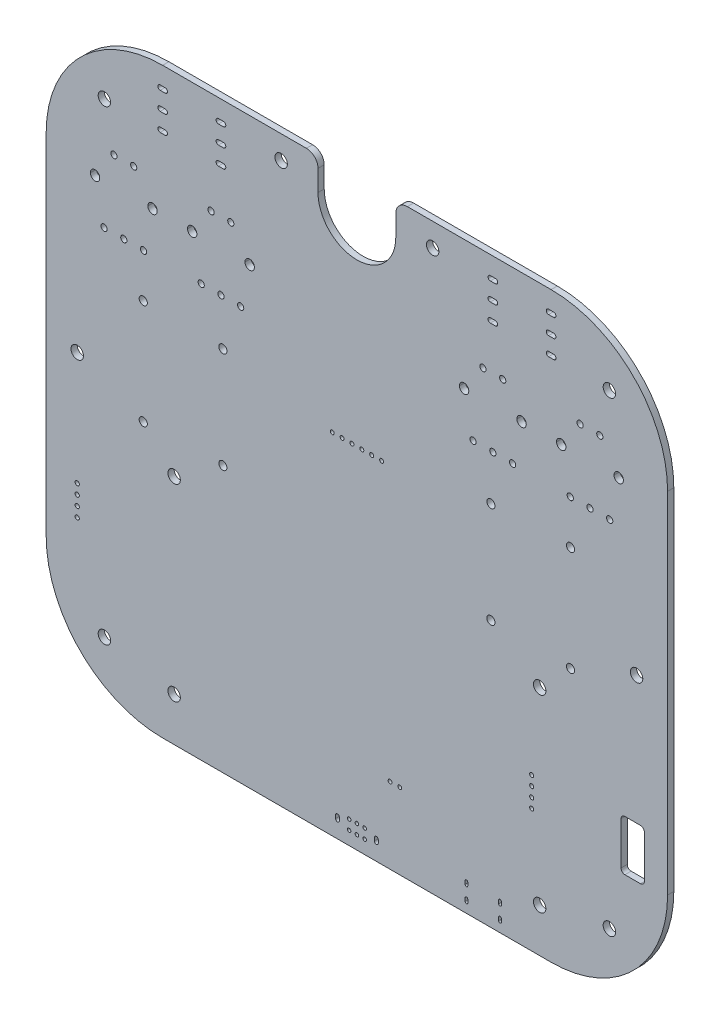
from build123d import *

# Parameters (mm, degrees)
SKETCH_1_R      = 1.6002032
SKETCH_1_R_2    = 0.8
SKETCH_1_R_3    = 1.05000254
SKETCH_1_R_4    = 1.60000254
SKETCH_1_R_5    = 0.52499365
SKETCH_1_R_6    = 0.5
SKETCH_1_R_7    = 0.51000762
SKETCH_1_R_8    = 0.457200914
SKETCH_1_R_9    = 0.5500127
EXTRUDE_1_DEPTH = 1.6000508


with BuildPart() as part:
    # 草图1 → 凸台-拉伸1 (new body)
    with BuildSketch(Plane.XY.offset(1.6000508)):
        with BuildLine():
            Line((0.012700025, 120.00023876), (0.012700025, 30.00006096))
            ThreePointArc((0.012700025, 30.00006096), (8.795794693, 8.795794693), (30.00006096, 0.012700025))
            Line((30.00006096, 0.012700025), (130.000259081, 0.012700025))
            ThreePointArc((130.000259081, 0.012700025), (151.204525347, 8.795794693), (159.987620015, 30.00006096))
            Line((159.987620015, 30.00006096), (159.987620015, 120.00023876))
            ThreePointArc((159.987620015, 120.00023876), (151.204525347, 141.204505027), (130.000259081, 149.987599695))
            Line((130.000259081, 149.987599695), (93.00018542, 149.987599695))
            ThreePointArc((93.00018542, 149.987599695), (90.887841759, 149.112638302), (90.012880366, 147.000294641))
            Line((90.012880366, 147.000294641), (90.012880366, 141.625283211))
            ThreePointArc((90.012880366, 141.625283211), (80.00016002, 131.612562865), (69.987439675, 141.625283211))
            Line((69.987439675, 141.625283211), (69.987439675, 147.000294641))
            ThreePointArc((69.987439675, 147.000294641), (69.112478282, 149.112638302), (67.00013462, 149.987599695))
            Line((67.00013462, 149.987599695), (30.00006096, 149.987599695))
            ThreePointArc((30.00006096, 149.987599695), (8.795794693, 141.204505027), (0.012700025, 120.00023876))
        make_face()
        with Locations(Location((152.000304801, 75.00014986, 0), (0, 0, 180))):
            Circle(SKETCH_1_R, mode=Mode.SUBTRACT)
        with Locations(Location((145.080289561, 106.250419101, 0), (0, 0, 180))):
            Circle(SKETCH_1_R_2, mode=Mode.SUBTRACT)
        with Locations(Location((145.000289561, 15.00003048, 0), (0, 0, 180))):
            Circle(SKETCH_1_R, mode=Mode.SUBTRACT)
        with Locations(Location((145.000289561, 135.000269241, 0), (0, 0, 180))):
            Circle(SKETCH_1_R, mode=Mode.SUBTRACT)
        with Locations(Location((142.540284481, 123.750292101, 0), (0, 0, 180))):
            Circle(SKETCH_1_R_2, mode=Mode.SUBTRACT)
        with Locations(Location((140.000279401, 106.2501651, 0), (0, 0, 180))):
            Circle(SKETCH_1_R_2, mode=Mode.SUBTRACT)
        with Locations(Location((137.460274321, 123.750292101, 0), (0, 0, 180))):
            Circle(SKETCH_1_R_2, mode=Mode.SUBTRACT)
        with Locations(Location((134.920269241, 106.250419101, 0), (0, 0, 180))):
            Circle(SKETCH_1_R_2, mode=Mode.SUBTRACT)
        with Locations(Location((135.000264161, 95.0001905, 0), (0, 0, 180))):
            Circle(SKETCH_1_R_3, mode=Mode.SUBTRACT)
        with Locations(Location((135.000264161, 68.014135128, 0), (0, 0, 180))):
            Circle(SKETCH_1_R_3, mode=Mode.SUBTRACT)
        with Locations(Location((127.050254001, 11.26002286, 0), (0, 0, 180))):
            Circle(SKETCH_1_R_4, mode=Mode.SUBTRACT)
        with Locations(Location((127.050254001, 59.80011938, 0), (0, 0, 180))):
            Circle(SKETCH_1_R_4, mode=Mode.SUBTRACT)
        with Locations(Location((125.00004572, 36.78008382, 0), (0, 0, 180))):
            Circle(SKETCH_1_R_5, mode=Mode.SUBTRACT)
        with Locations(Location((125.00004572, 34.28008382, 0), (0, 0, 180))):
            Circle(SKETCH_1_R_5, mode=Mode.SUBTRACT)
        with Locations(Location((125.00004572, 31.78005842, 0), (0, 0, 180))):
            Circle(SKETCH_1_R_5, mode=Mode.SUBTRACT)
        with Locations(Location((125.00004572, 39.28008382, 0), (0, 0, 180))):
            Circle(SKETCH_1_R_5, mode=Mode.SUBTRACT)
        with Locations(Location((120.0802413, 106.250419101, 0), (0, 0, 180))):
            Circle(SKETCH_1_R_2, mode=Mode.SUBTRACT)
        with Locations(Location((117.54023622, 123.750292101, 0), (0, 0, 180))):
            Circle(SKETCH_1_R_2, mode=Mode.SUBTRACT)
        with Locations(Location((115.00023114, 106.2501651, 0), (0, 0, 180))):
            Circle(SKETCH_1_R_2, mode=Mode.SUBTRACT)
        with Locations(Location((114.50022352, 94.50018796, 0), (0, 0, 180))):
            Circle(SKETCH_1_R_3, mode=Mode.SUBTRACT)
        with Locations(Location((114.50022352, 68.50013716, 0), (0, 0, 180))):
            Circle(SKETCH_1_R_3, mode=Mode.SUBTRACT)
        with Locations(Location((112.46022606, 123.750292101, 0), (0, 0, 180))):
            Circle(SKETCH_1_R_2, mode=Mode.SUBTRACT)
        with Locations(Location((109.92022098, 106.250419101, 0), (0, 0, 180))):
            Circle(SKETCH_1_R_2, mode=Mode.SUBTRACT)
        with Locations(Location((99.50019812, 144.000289561, 0), (0, 0, 180))):
            Circle(SKETCH_1_R_4, mode=Mode.SUBTRACT)
        with Locations(Location((91.039243078, 19.558039116, 0), (0, 0, 180))):
            Circle(SKETCH_1_R_6, mode=Mode.SUBTRACT)
        with Locations(Location((88.539243078, 19.558039116, 0), (0, 0, 180))):
            Circle(SKETCH_1_R_6, mode=Mode.SUBTRACT)
        with Locations(Location((86.35017272, 90.00018034, 0), (0, 0, 180))):
            Circle(SKETCH_1_R_7, mode=Mode.SUBTRACT)
        with Locations(Location((83.81016764, 90.00018034, 0), (0, 0, 180))):
            Circle(SKETCH_1_R_7, mode=Mode.SUBTRACT)
        with Locations(Location((82.00016002, 3.448996698, 0), (0, 0, 180))):
            Circle(SKETCH_1_R_8, mode=Mode.SUBTRACT)
        with Locations(Location((82.00016002, 5.949022098, 0), (0, 0, 180))):
            Circle(SKETCH_1_R_8, mode=Mode.SUBTRACT)
        with Locations(Location((81.27016256, 90.00018034, 0), (0, 0, 180))):
            Circle(SKETCH_1_R_7, mode=Mode.SUBTRACT)
        with Locations(Location((80.00016002, 3.448996698, 0), (0, 0, 180))):
            Circle(SKETCH_1_R_8, mode=Mode.SUBTRACT)
        with Locations(Location((80.00016002, 5.949022098, 0), (0, 0, 180))):
            Circle(SKETCH_1_R_8, mode=Mode.SUBTRACT)
        with Locations(Location((78.73015748, 90.00018034, 0), (0, 0, 180))):
            Circle(SKETCH_1_R_7, mode=Mode.SUBTRACT)
        with Locations(Location((78.00016002, 5.949022098, 0), (0, 0, 180))):
            Circle(SKETCH_1_R_8, mode=Mode.SUBTRACT)
        with Locations(Location((78.00016002, 3.448996698, 0), (0, 0, 180))):
            Circle(SKETCH_1_R_8, mode=Mode.SUBTRACT)
        with Locations(Location((76.1901524, 90.00018034, 0), (0, 0, 180))):
            Circle(SKETCH_1_R_7, mode=Mode.SUBTRACT)
        with Locations(Location((73.65014732, 90.00018034, 0), (0, 0, 180))):
            Circle(SKETCH_1_R_7, mode=Mode.SUBTRACT)
        with Locations(Location((60.50012192, 144.000289561, 0), (0, 0, 180))):
            Circle(SKETCH_1_R_4, mode=Mode.SUBTRACT)
        with Locations(Location((50.08009906, 106.250419101, 0), (0, 0, 180))):
            Circle(SKETCH_1_R_2, mode=Mode.SUBTRACT)
        with Locations(Location((47.54009398, 123.750292101, 0), (0, 0, 180))):
            Circle(SKETCH_1_R_2, mode=Mode.SUBTRACT)
        with Locations(Location((45.50009144, 94.514196088, 0), (0, 0, 180))):
            Circle(SKETCH_1_R_3, mode=Mode.SUBTRACT)
        with Locations(Location((45.50009144, 68.514145288, 0), (0, 0, 180))):
            Circle(SKETCH_1_R_3, mode=Mode.SUBTRACT)
        with Locations(Location((45.0000889, 106.2501651, 0), (0, 0, 180))):
            Circle(SKETCH_1_R_2, mode=Mode.SUBTRACT)
        with Locations(Location((42.46008382, 123.750292101, 0), (0, 0, 180))):
            Circle(SKETCH_1_R_2, mode=Mode.SUBTRACT)
        with Locations(Location((39.92007874, 106.250419101, 0), (0, 0, 180))):
            Circle(SKETCH_1_R_2, mode=Mode.SUBTRACT)
        with Locations(Location((32.95006604, 11.26002286, 0), (0, 0, 180))):
            Circle(SKETCH_1_R_4, mode=Mode.SUBTRACT)
        with Locations(Location((32.95006604, 59.80011938, 0), (0, 0, 180))):
            Circle(SKETCH_1_R_4, mode=Mode.SUBTRACT)
        with Locations(Location((25.0800508, 106.250419101, 0), (0, 0, 180))):
            Circle(SKETCH_1_R_2, mode=Mode.SUBTRACT)
        with Locations(Location((25.0000508, 95.00019812, 0), (0, 0, 180))):
            Circle(SKETCH_1_R_3, mode=Mode.SUBTRACT)
        with Locations(Location((25.0000508, 68.014142748, 0), (0, 0, 180))):
            Circle(SKETCH_1_R_3, mode=Mode.SUBTRACT)
        with Locations(Location((22.54004572, 123.750292101, 0), (0, 0, 180))):
            Circle(SKETCH_1_R_2, mode=Mode.SUBTRACT)
        with Locations(Location((20.00004064, 106.2501651, 0), (0, 0, 180))):
            Circle(SKETCH_1_R_2, mode=Mode.SUBTRACT)
        with Locations(Location((17.46003556, 123.750292101, 0), (0, 0, 180))):
            Circle(SKETCH_1_R_2, mode=Mode.SUBTRACT)
        with Locations(Location((14.92003048, 106.250419101, 0), (0, 0, 180))):
            Circle(SKETCH_1_R_2, mode=Mode.SUBTRACT)
        with Locations(Location((15.00003048, 15.00003048, 0), (0, 0, 180))):
            Circle(SKETCH_1_R, mode=Mode.SUBTRACT)
        with Locations(Location((15.00002794, 135.000269241, 0), (0, 0, 180))):
            Circle(SKETCH_1_R, mode=Mode.SUBTRACT)
        with Locations(Location((8.00001524, 38.1900762, 0), (0, 0, 180))):
            Circle(SKETCH_1_R_9, mode=Mode.SUBTRACT)
        with Locations(Location((8.00001524, 40.73008128, 0), (0, 0, 180))):
            Circle(SKETCH_1_R_9, mode=Mode.SUBTRACT)
        with Locations(Location((8.00001524, 43.27008636, 0), (0, 0, 180))):
            Circle(SKETCH_1_R_9, mode=Mode.SUBTRACT)
        with Locations(Location((8.00001524, 45.81009144, 0), (0, 0, 180))):
            Circle(SKETCH_1_R_9, mode=Mode.SUBTRACT)
        with Locations(Location((8.00001524, 75.00014986, 0), (0, 0, 180))):
            Circle(SKETCH_1_R, mode=Mode.SUBTRACT)
        with BuildLine():
            Line((148.000297181, 30.03006096), (148.000297181, 41.03008128))
            ThreePointArc((148.000297181, 41.03008128), (148.293191143, 41.737189857), (149.000299721, 42.03008382))
            Line((149.000299721, 42.03008382), (153.000307341, 42.03008382))
            ThreePointArc((153.000307341, 42.03008382), (153.707415918, 41.737189857), (154.000309881, 41.03008128))
            Line((154.000309881, 41.03008128), (154.000309881, 30.03006096))
            ThreePointArc((154.000309881, 30.03006096), (153.707415918, 29.322952383), (153.000307341, 29.03005842))
            Line((153.000307341, 29.03005842), (149.000299721, 29.03005842))
            ThreePointArc((149.000299721, 29.03005842), (148.293191143, 29.322952383), (148.000297181, 30.03006096))
        make_face(mode=Mode.SUBTRACT)
        with BuildLine():
            Line((148.600279401, 116.800279401), (148.600279401, 116.700304801))
            ThreePointArc((148.600279401, 116.700304801), (147.400279401, 115.500304801), (146.200279401, 116.700304801))
            Line((146.200279401, 116.700304801), (146.200279401, 116.800279401))
            ThreePointArc((146.200279401, 116.800279401), (147.400279401, 118.000279401), (148.600279401, 116.800279401))
        make_face(mode=Mode.SUBTRACT)
        with BuildLine():
            Line((133.800279401, 116.800279401), (133.800279401, 116.700304801))
            ThreePointArc((133.800279401, 116.700304801), (132.600279401, 115.500304801), (131.400279401, 116.700304801))
            Line((131.400279401, 116.700304801), (131.400279401, 116.800279401))
            ThreePointArc((131.400279401, 116.800279401), (132.600279401, 118.000279401), (133.800279401, 116.800279401))
        make_face(mode=Mode.SUBTRACT)
        with BuildLine():
            Line((130.650271781, 139.400279401), (129.350271781, 139.400279401))
            ThreePointArc((129.350271781, 139.400279401), (128.750271781, 140.000279401), (129.350271781, 140.600279401))
            Line((129.350271781, 140.600279401), (130.650271781, 140.600279401))
            ThreePointArc((130.650271781, 140.600279401), (131.250271781, 140.000279401), (130.650271781, 139.400279401))
        make_face(mode=Mode.SUBTRACT)
        with BuildLine():
            Line((130.650271781, 134.700279401), (129.350271781, 134.700279401))
            ThreePointArc((129.350271781, 134.700279401), (128.750271781, 135.300279401), (129.350271781, 135.900279401))
            Line((129.350271781, 135.900279401), (130.650271781, 135.900279401))
            ThreePointArc((130.650271781, 135.900279401), (131.250271781, 135.300279401), (130.650271781, 134.700279401))
        make_face(mode=Mode.SUBTRACT)
        with BuildLine():
            Line((130.650271781, 144.100279401), (129.350271781, 144.100279401))
            ThreePointArc((129.350271781, 144.100279401), (128.750271781, 144.700279401), (129.350271781, 145.300279401))
            Line((129.350271781, 145.300279401), (130.650271781, 145.300279401))
            ThreePointArc((130.650271781, 145.300279401), (131.250271781, 144.700279401), (130.650271781, 144.100279401))
        make_face(mode=Mode.SUBTRACT)
        with BuildLine():
            Line((123.60023114, 116.800279401), (123.60023114, 116.700304801))
            ThreePointArc((123.60023114, 116.700304801), (122.40023114, 115.500304801), (121.20023114, 116.700304801))
            Line((121.20023114, 116.700304801), (121.20023114, 116.800279401))
            ThreePointArc((121.20023114, 116.800279401), (122.40023114, 118.000279401), (123.60023114, 116.800279401))
        make_face(mode=Mode.SUBTRACT)
        with BuildLine():
            Line((117.193294387, 7.125984252), (117.193294387, 6.325882652))
            ThreePointArc((117.193294387, 6.325882652), (116.842773686, 5.975361951), (116.492252984, 6.325882652))
            Line((116.492252984, 6.325882652), (116.492252984, 7.125984252))
            ThreePointArc((116.492252984, 7.125984252), (116.842773686, 7.476504953), (117.193294387, 7.125984252))
        make_face(mode=Mode.SUBTRACT)
        with BuildLine():
            Line((117.193294387, 3.326136652), (117.193294387, 2.526035052))
            ThreePointArc((117.193294387, 2.526035052), (116.842773686, 2.175514351), (116.492252984, 2.526035052))
            Line((116.492252984, 2.526035052), (116.492252984, 3.326136652))
            ThreePointArc((116.492252984, 3.326136652), (116.842773686, 3.676657353), (117.193294387, 3.326136652))
        make_face(mode=Mode.SUBTRACT)
        with BuildLine():
            Line((115.65024384, 139.400279401), (114.35024384, 139.400279401))
            ThreePointArc((114.35024384, 139.400279401), (113.75024384, 140.000279401), (114.35024384, 140.600279401))
            Line((114.35024384, 140.600279401), (115.65024384, 140.600279401))
            ThreePointArc((115.65024384, 140.600279401), (116.25024384, 140.000279401), (115.65024384, 139.400279401))
        make_face(mode=Mode.SUBTRACT)
        with BuildLine():
            Line((115.65024384, 134.700279401), (114.35024384, 134.700279401))
            ThreePointArc((114.35024384, 134.700279401), (113.75024384, 135.300279401), (114.35024384, 135.900279401))
            Line((114.35024384, 135.900279401), (115.65024384, 135.900279401))
            ThreePointArc((115.65024384, 135.900279401), (116.25024384, 135.300279401), (115.65024384, 134.700279401))
        make_face(mode=Mode.SUBTRACT)
        with BuildLine():
            Line((115.65024384, 144.100279401), (114.35024384, 144.100279401))
            ThreePointArc((114.35024384, 144.100279401), (113.75024384, 144.700279401), (114.35024384, 145.300279401))
            Line((114.35024384, 145.300279401), (115.65024384, 145.300279401))
            ThreePointArc((115.65024384, 145.300279401), (116.25024384, 144.700279401), (115.65024384, 144.100279401))
        make_face(mode=Mode.SUBTRACT)
        with BuildLine():
            Line((108.552197104, 7.125984252), (108.552197104, 6.325882652))
            ThreePointArc((108.552197104, 6.325882652), (108.201676403, 5.975361951), (107.851155702, 6.325882652))
            Line((107.851155702, 6.325882652), (107.851155702, 7.125984252))
            ThreePointArc((107.851155702, 7.125984252), (108.201676403, 7.476504953), (108.552197104, 7.125984252))
        make_face(mode=Mode.SUBTRACT)
        with BuildLine():
            Line((108.552197104, 3.326136652), (108.552197104, 2.526035052))
            ThreePointArc((108.552197104, 2.526035052), (108.201676403, 2.175514351), (107.851155702, 2.526035052))
            Line((107.851155702, 2.526035052), (107.851155702, 3.326136652))
            ThreePointArc((107.851155702, 3.326136652), (108.201676403, 3.676657353), (108.552197104, 3.326136652))
        make_face(mode=Mode.SUBTRACT)
        with BuildLine():
            Line((108.80023114, 116.800279401), (108.80023114, 116.700304801))
            ThreePointArc((108.80023114, 116.700304801), (107.60023114, 115.500304801), (106.40023114, 116.700304801))
            Line((106.40023114, 116.700304801), (106.40023114, 116.800279401))
            ThreePointArc((106.40023114, 116.800279401), (107.60023114, 118.000279401), (108.80023114, 116.800279401))
        make_face(mode=Mode.SUBTRACT)
        with BuildLine():
            Line((85.50017272, 5.099009398), (85.50017272, 4.299009398))
            ThreePointArc((85.50017272, 4.299009398), (85.00017272, 3.799009398), (84.50017272, 4.299009398))
            Line((84.50017272, 4.299009398), (84.50017272, 5.099009398))
            ThreePointArc((84.50017272, 5.099009398), (85.00017272, 5.599009398), (85.50017272, 5.099009398))
        make_face(mode=Mode.SUBTRACT)
        with BuildLine():
            Line((75.50014732, 5.099009398), (75.50014732, 4.299009398))
            ThreePointArc((75.50014732, 4.299009398), (75.00014732, 3.799009398), (74.50014732, 4.299009398))
            Line((74.50014732, 4.299009398), (74.50014732, 5.099009398))
            ThreePointArc((74.50014732, 5.099009398), (75.00014732, 5.599009398), (75.50014732, 5.099009398))
        make_face(mode=Mode.SUBTRACT)
        with BuildLine():
            Line((53.6000889, 116.800279401), (53.6000889, 116.700304801))
            ThreePointArc((53.6000889, 116.700304801), (52.4000889, 115.500304801), (51.2000889, 116.700304801))
            Line((51.2000889, 116.700304801), (51.2000889, 116.800279401))
            ThreePointArc((51.2000889, 116.800279401), (52.4000889, 118.000279401), (53.6000889, 116.800279401))
        make_face(mode=Mode.SUBTRACT)
        with BuildLine():
            Line((45.6501016, 144.100279401), (44.3501016, 144.100279401))
            ThreePointArc((44.3501016, 144.100279401), (43.7501016, 144.700279401), (44.3501016, 145.300279401))
            Line((44.3501016, 145.300279401), (45.6501016, 145.300279401))
            ThreePointArc((45.6501016, 145.300279401), (46.2501016, 144.700279401), (45.6501016, 144.100279401))
        make_face(mode=Mode.SUBTRACT)
        with BuildLine():
            Line((45.6501016, 139.400279401), (44.3501016, 139.400279401))
            ThreePointArc((44.3501016, 139.400279401), (43.7501016, 140.000279401), (44.3501016, 140.600279401))
            Line((44.3501016, 140.600279401), (45.6501016, 140.600279401))
            ThreePointArc((45.6501016, 140.600279401), (46.2501016, 140.000279401), (45.6501016, 139.400279401))
        make_face(mode=Mode.SUBTRACT)
        with BuildLine():
            Line((45.6501016, 134.700279401), (44.3501016, 134.700279401))
            ThreePointArc((44.3501016, 134.700279401), (43.7501016, 135.300279401), (44.3501016, 135.900279401))
            Line((44.3501016, 135.900279401), (45.6501016, 135.900279401))
            ThreePointArc((45.6501016, 135.900279401), (46.2501016, 135.300279401), (45.6501016, 134.700279401))
        make_face(mode=Mode.SUBTRACT)
        with BuildLine():
            Line((38.8000889, 116.800279401), (38.8000889, 116.700304801))
            ThreePointArc((38.8000889, 116.700304801), (37.6000889, 115.500304801), (36.4000889, 116.700304801))
            Line((36.4000889, 116.700304801), (36.4000889, 116.800279401))
            ThreePointArc((36.4000889, 116.800279401), (37.6000889, 118.000279401), (38.8000889, 116.800279401))
        make_face(mode=Mode.SUBTRACT)
        with BuildLine():
            Line((30.65007366, 139.400279401), (29.35007366, 139.400279401))
            ThreePointArc((29.35007366, 139.400279401), (28.75007366, 140.000279401), (29.35007366, 140.600279401))
            Line((29.35007366, 140.600279401), (30.65007366, 140.600279401))
            ThreePointArc((30.65007366, 140.600279401), (31.25007366, 140.000279401), (30.65007366, 139.400279401))
        make_face(mode=Mode.SUBTRACT)
        with BuildLine():
            Line((30.65007366, 134.700279401), (29.35007366, 134.700279401))
            ThreePointArc((29.35007366, 134.700279401), (28.75007366, 135.300279401), (29.35007366, 135.900279401))
            Line((29.35007366, 135.900279401), (30.65007366, 135.900279401))
            ThreePointArc((30.65007366, 135.900279401), (31.25007366, 135.300279401), (30.65007366, 134.700279401))
        make_face(mode=Mode.SUBTRACT)
        with BuildLine():
            Line((30.65007366, 144.100279401), (29.35007366, 144.100279401))
            ThreePointArc((29.35007366, 144.100279401), (28.75007366, 144.700279401), (29.35007366, 145.300279401))
            Line((29.35007366, 145.300279401), (30.65007366, 145.300279401))
            ThreePointArc((30.65007366, 145.300279401), (31.25007366, 144.700279401), (30.65007366, 144.100279401))
        make_face(mode=Mode.SUBTRACT)
        with BuildLine():
            Line((28.60004064, 116.800279401), (28.60004064, 116.700304801))
            ThreePointArc((28.60004064, 116.700304801), (27.40004064, 115.500304801), (26.20004064, 116.700304801))
            Line((26.20004064, 116.700304801), (26.20004064, 116.800279401))
            ThreePointArc((26.20004064, 116.800279401), (27.40004064, 118.000279401), (28.60004064, 116.800279401))
        make_face(mode=Mode.SUBTRACT)
        with BuildLine():
            Line((13.80004064, 116.800279401), (13.80004064, 116.700304801))
            ThreePointArc((13.80004064, 116.700304801), (12.60004064, 115.500304801), (11.40004064, 116.700304801))
            Line((11.40004064, 116.700304801), (11.40004064, 116.800279401))
            ThreePointArc((11.40004064, 116.800279401), (12.60004064, 118.000279401), (13.80004064, 116.800279401))
        make_face(mode=Mode.SUBTRACT)
    extrude(amount=-EXTRUDE_1_DEPTH)


solid = part.part
